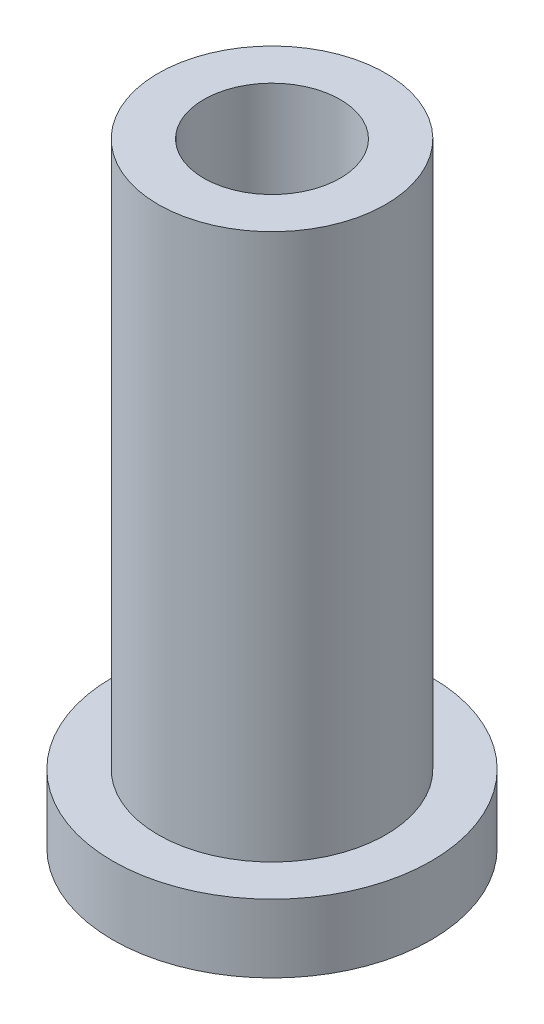
from build123d import *


with BuildPart() as part:
    # Esquisse1 → Révolution1 (revolve)
    with BuildSketch(Plane.XY, mode=Mode.PRIVATE) as r_volution1_sk:
        Polygon((6, 40.341463415), (6, -13.658536585), (14, -13.658536585), (14, -7.658536585), (10, -7.658536585), (10, 40.341463415), align=None)
    revolve(r_volution1_sk.sketch.rotate(Axis((0, 18.341463415, 0), (0, -1, 0)), 90), axis=Axis((0, 18.341463415, 0), (0, -1, 0)))


solid = part.part
